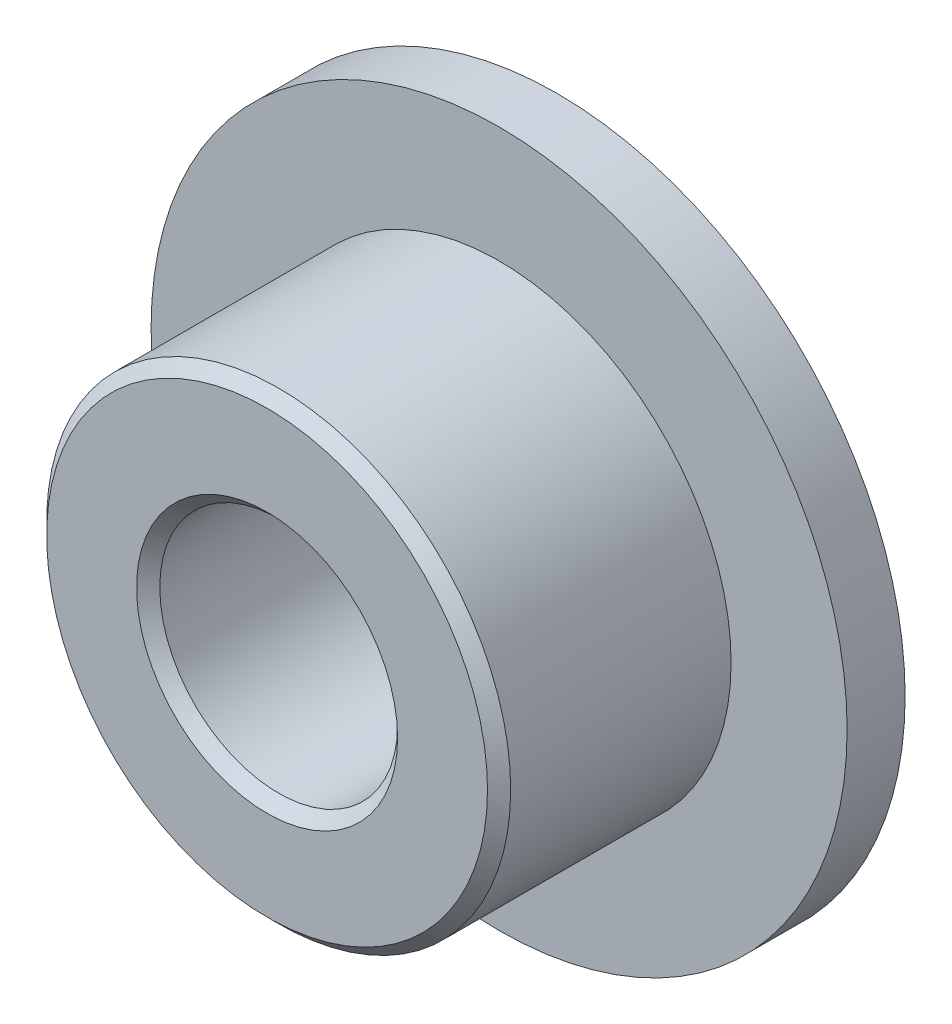
from build123d import *

# Parameters (mm, degrees)
SKETCH_1_R          = 6
EXTRUDE_1_DEPTH     = 1
SKETCH_2_R          = 4
EXTRUDE_2_DEPTH     = 4
SKETCH_3_R          = 2.05
CUT_EXTRUDE_1_DEPTH = 10.848857802
CHAMFER_1_SIZE      = 0.2


with BuildPart() as part:
    # 草图1 → 凸台-拉伸1 (new body)
    with BuildSketch(Plane.XY):
        Circle(SKETCH_1_R)
    extrude(amount=EXTRUDE_1_DEPTH)

    # 草图2 → 凸台-拉伸2 (add)
    with BuildSketch(Plane.XY.offset(1)):
        Circle(SKETCH_2_R)
    extrude(amount=EXTRUDE_2_DEPTH)

    # 草图3 → 切除-拉伸1 (cut, through all)
    with BuildSketch(Plane.XY.offset(5)):
        Circle(SKETCH_3_R)
    extrude(amount=-CUT_EXTRUDE_1_DEPTH, mode=Mode.SUBTRACT)

    # 倒角1
    chamfer_1_edges = [part.edges().sort_by_distance(p)[0] for p in [
        (-2.05, 0, 0),
        (-2.05, 0, 5),
        (-4, 0, 5),
    ]]
    chamfer(chamfer_1_edges, length=CHAMFER_1_SIZE)


solid = part.part
